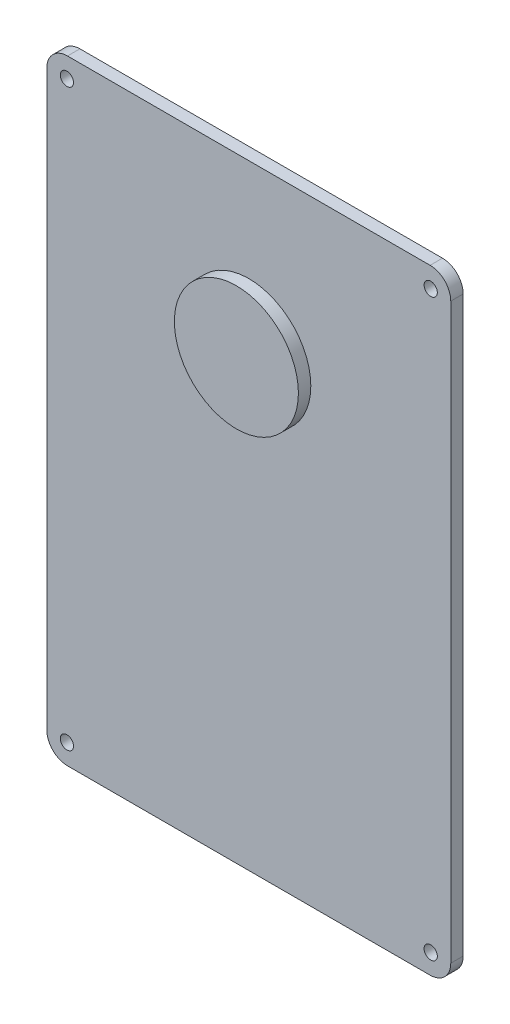
from build123d import *

# Parameters (mm, degrees)
SKETCH_1_W          = 97.7
SKETCH_1_H          = 148.7
EXTRUDE_1_DEPTH     = 3
FILLET_1_R          = 5
CUT_EXTRUDE_1_REACH = 91.013
SKETCH_2_R          = 1.6
SKETCH_3_R          = 15
EXTRUDE_2_DEPTH     = 3
CUT_EXTRUDE_2_DEPTH = 4.5
CUT_EXTRUDE_START   = 3
SKETCH_5_R          = 12.5
CUT_EXTRUDE_3_DEPTH = 3
SKETCH_6_W          = 10.2
SKETCH_6_H          = 120.3
SKETCH_6_W_2        = 30.1
SKETCH_6_H_2        = 10.1
CUT_EXTRUDE_4_DEPTH = 2.1


with BuildPart() as part:
    # 草图1 → 凸台-拉伸1 (new body)
    with BuildSketch(Plane.XY):
        Rectangle(SKETCH_1_W, SKETCH_1_H)
    extrude(amount=EXTRUDE_1_DEPTH)

    # 圆角1
    fillet_1_edges = [part.edges().sort_by_distance(p)[0] for p in [
        (-48.85, 74.35, 1.5),
        (48.85, 74.35, 1.5),
        (48.85, -74.35, 1.5),
        (-48.85, -74.35, 1.5),
    ]]
    fillet(fillet_1_edges, radius=FILLET_1_R)

    # 草图2 → 切除-拉伸1 (cut, up to next)
    with BuildSketch(Plane.XY.offset(3), mode=Mode.PRIVATE) as cut_extrude_1_sk1:
        with Locations((-44, 69.5)):
            Circle(SKETCH_2_R)
    cut_extrude_1_tool1 = extrude(cut_extrude_1_sk1.sketch, amount=-CUT_EXTRUDE_1_REACH, mode=Mode.PRIVATE) & part.part
    # 草图2 → 切除-拉伸1 (cut, up to next)
    with BuildSketch(Plane.XY.offset(3), mode=Mode.PRIVATE) as cut_extrude_1_sk2:
        with Locations((44, 69.5)):
            Circle(SKETCH_2_R)
    cut_extrude_1_tool2 = extrude(cut_extrude_1_sk2.sketch, amount=-CUT_EXTRUDE_1_REACH, mode=Mode.PRIVATE) & part.part
    # 草图2 → 切除-拉伸1 (cut, up to next)
    with BuildSketch(Plane.XY.offset(3), mode=Mode.PRIVATE) as cut_extrude_1_sk3:
        with Locations((-44, -69.5)):
            Circle(SKETCH_2_R)
    cut_extrude_1_tool3 = extrude(cut_extrude_1_sk3.sketch, amount=-CUT_EXTRUDE_1_REACH, mode=Mode.PRIVATE) & part.part
    # 草图2 → 切除-拉伸1 (cut, up to next)
    with BuildSketch(Plane.XY.offset(3), mode=Mode.PRIVATE) as cut_extrude_1_sk4:
        with Locations((44, -69.5)):
            Circle(SKETCH_2_R)
    cut_extrude_1_tool4 = extrude(cut_extrude_1_sk4.sketch, amount=-CUT_EXTRUDE_1_REACH, mode=Mode.PRIVATE) & part.part
    add(cut_extrude_1_tool1.solids().sort_by_distance((-44, 69.5, 3))[0], mode=Mode.SUBTRACT)
    add(cut_extrude_1_tool2.solids().sort_by_distance((44, 69.5, 3))[0], mode=Mode.SUBTRACT)
    add(cut_extrude_1_tool3.solids().sort_by_distance((-44, -69.5, 3))[0], mode=Mode.SUBTRACT)
    add(cut_extrude_1_tool4.solids().sort_by_distance((44, -69.5, 3))[0], mode=Mode.SUBTRACT)

    # 草图3 → 凸台-拉伸2 (add)
    with BuildSketch(Plane.XY.offset(3)):
        with Locations((0, 34.65)):
            Circle(SKETCH_3_R)
    extrude(amount=EXTRUDE_2_DEPTH)

    # 草图4 → 切除-拉伸2 (cut)
    with BuildSketch(Plane(origin=(0, 0, 0), x_dir=(-1, 0, 0), z_dir=(0, 0, -1))):
        with BuildLine():
            Line((-12.5, 34.65), (12.5, 34.65))
            ThreePointArc((12.5, 34.65), (0, 22.15), (-12.5, 34.65))
        make_face()
    extrude(amount=-CUT_EXTRUDE_2_DEPTH, mode=Mode.SUBTRACT)

    # 草图5 → 切除-拉伸3 (cut)
    with BuildSketch(Plane(origin=(0, 0, 4.5), x_dir=(-1, 0, 0), z_dir=(0, 0, -1)).offset(CUT_EXTRUDE_START)):
        with Locations((0, 34.65)):
            Circle(SKETCH_5_R)
    extrude(amount=-CUT_EXTRUDE_3_DEPTH, mode=Mode.SUBTRACT)

    # 草图6 → 切除-拉伸4 (cut)
    with BuildSketch(Plane(origin=(0, 0, 0), x_dir=(-1, 0, 0), z_dir=(0, 0, -1))):
        with Locations((-33.75, -4.2)):
            Rectangle(SKETCH_6_W, SKETCH_6_H)
        Polygon((28.65, 55.9), (32.118068627, -64.35), (38.85, -64.35), (38.85, 55.9), align=None)
        with Locations((0, 61)):
            Rectangle(SKETCH_6_W_2, SKETCH_6_H_2)
        with Locations((0, -59.3)):
            Rectangle(SKETCH_6_W_2, SKETCH_6_H_2)
    extrude(amount=-CUT_EXTRUDE_4_DEPTH, mode=Mode.SUBTRACT)


solid = part.part
